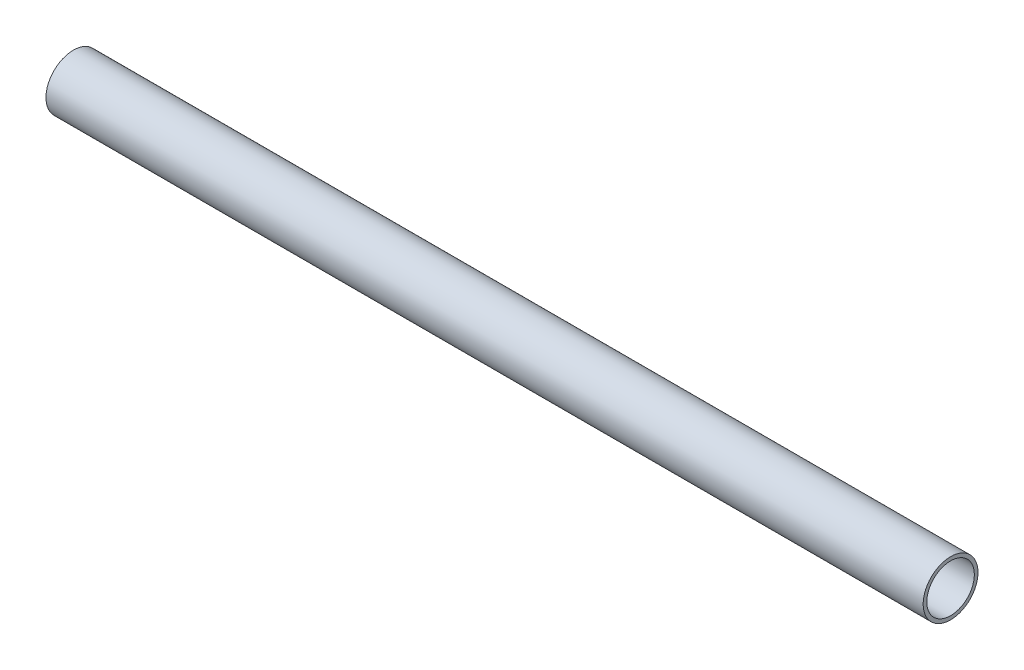
from build123d import *

# Parameters (mm, degrees)
SKETCH_1_R      = 7.5
SKETCH_1_R_2    = 6.5
EXTRUDE_1_DEPTH = 240


with BuildPart() as part:
    # 草图1 → 凸台-拉伸1 (new body)
    with BuildSketch(Plane(origin=(0, 0, 0), x_dir=(0, 0, -1), z_dir=(1, 0, 0))):
        Circle(SKETCH_1_R)
        Circle(SKETCH_1_R_2, mode=Mode.SUBTRACT)
    extrude(amount=EXTRUDE_1_DEPTH)


solid = part.part
